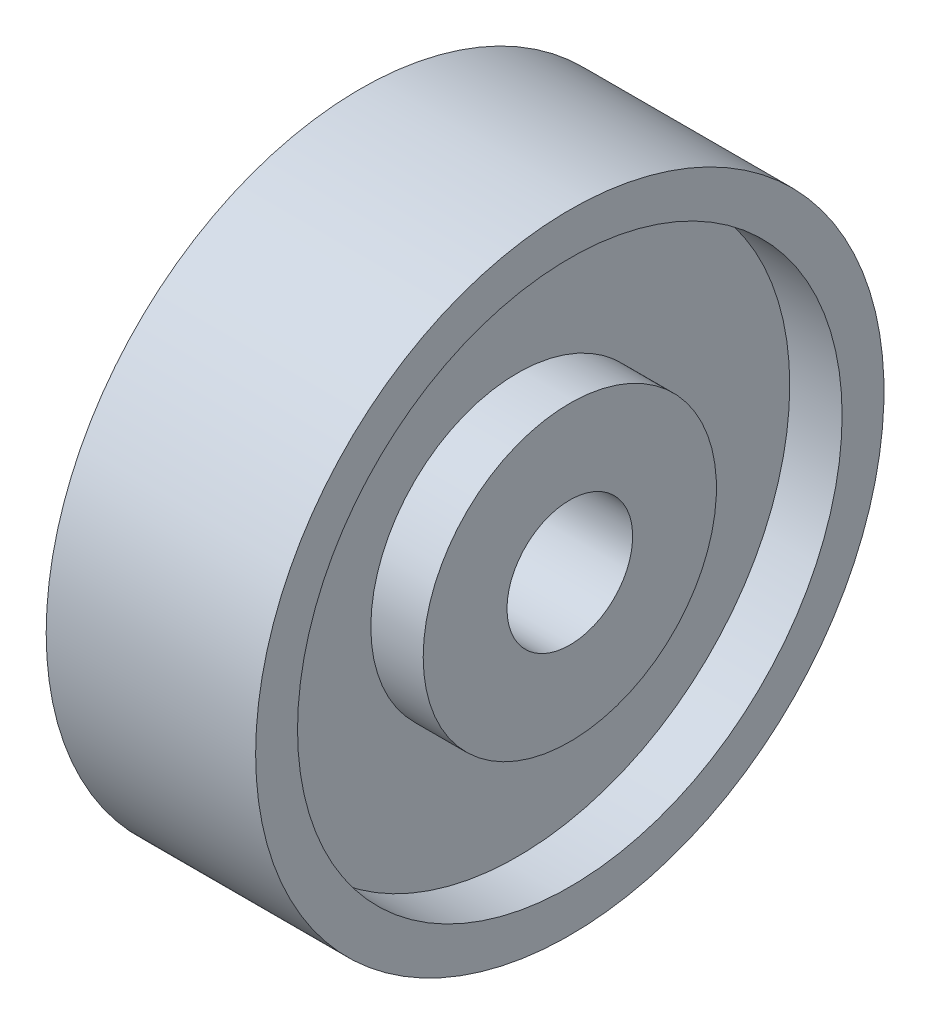
from build123d import *


with BuildPart() as part:
    # Sketch1 → Revolve1 (revolve)
    with BuildSketch(Plane.XY, mode=Mode.PRIVATE) as revolve1_sk:
        Polygon((-5, 3), (5, 3), (5, 7), (2.5, 7), (2.5, 13), (5, 13), (5, 15), (-5, 15), (-5, 13), (-2.5, 13), (-2.5, 7), (-5, 7), align=None)
    revolve(revolve1_sk.sketch.rotate(Axis((-265.452917719, 0, 0), (1, 0, 0)), 90), axis=Axis((-265.452917719, 0, 0), (1, 0, 0)))


solid = part.part
